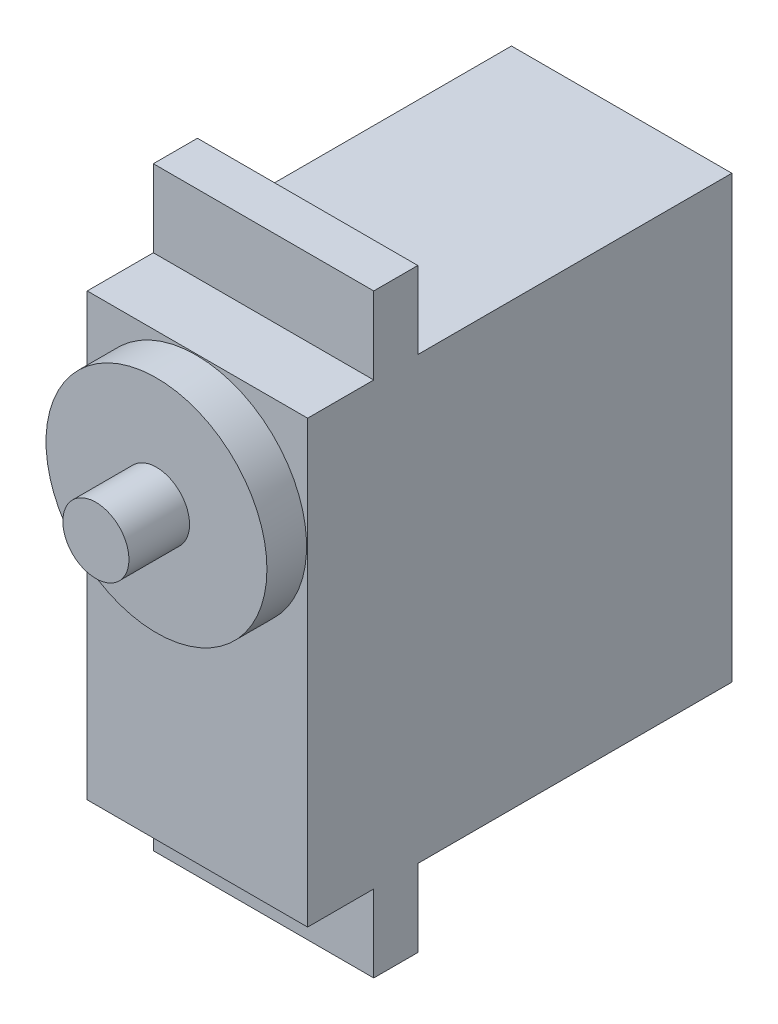
from build123d import *

# Parameters (mm, degrees)
CROQUIS1_W              = 54
CROQUIS1_H              = 20
SALIENTE_EXTRUIR1_DEPTH = 4
CROQUIS2_W              = 20
CROQUIS2_H              = 40
SALIENTE_EXTRUIR2_DEPTH = 6
CROQUIS3_R              = 10.02395417
SALIENTE_EXTRUIR3_DEPTH = 3.6
CROQUIS4_R              = 3
SALIENTE_EXTRUIR4_DEPTH = 5.5
CROQUIS5_W              = 20
CROQUIS5_H              = 40
SALIENTE_EXTRUIR5_DEPTH = 28.5


with BuildPart() as part:
    # Croquis1 → Saliente-Extruir1 (new body)
    with BuildSketch(Plane(origin=(0, 0, 0), x_dir=(0, 1, 0), z_dir=(0, 0, 1))):
        Rectangle(CROQUIS1_W, CROQUIS1_H)
    extrude(amount=SALIENTE_EXTRUIR1_DEPTH)

    # Croquis2 → Saliente-Extruir2 (add)
    with BuildSketch(Plane.XY.offset(4)):
        Rectangle(CROQUIS2_W, CROQUIS2_H)
    extrude(amount=SALIENTE_EXTRUIR2_DEPTH)

    # Croquis3 → Saliente-Extruir3 (add)
    with BuildSketch(Plane.XY.offset(10)):
        with Locations(Location((-0.116229886, 9.884437844, 0), (0, 0, 189.593450482))):
            Circle(CROQUIS3_R)
    extrude(amount=SALIENTE_EXTRUIR3_DEPTH)

    # Croquis4 → Saliente-Extruir4 (add)
    with BuildSketch(Plane.XY.offset(13.6)):
        with Locations((-0.116229886, 9.884437844)):
            Circle(CROQUIS4_R)
    extrude(amount=SALIENTE_EXTRUIR4_DEPTH)

    # Croquis5 → Saliente-Extruir5 (add)
    with BuildSketch(Plane(origin=(0, 0, 0), x_dir=(1, 0, 0), z_dir=(0, 0, -1))):
        Rectangle(CROQUIS5_W, CROQUIS5_H)
    extrude(amount=SALIENTE_EXTRUIR5_DEPTH)


solid = part.part
